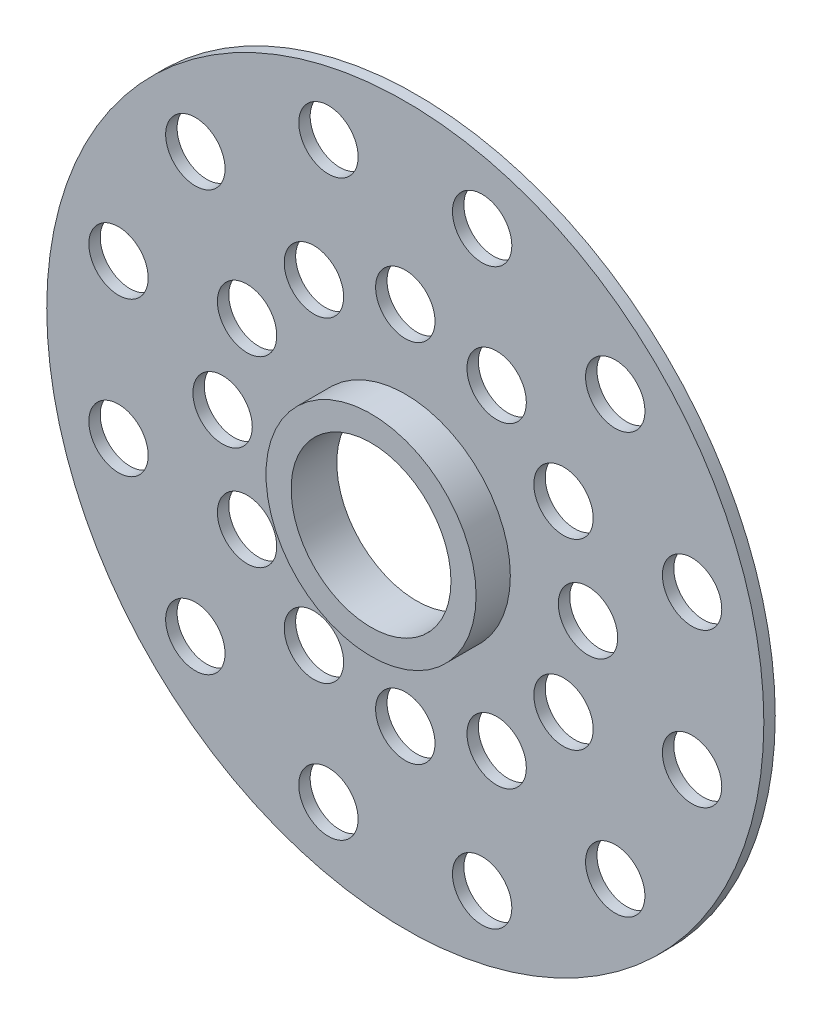
from build123d import *

# Parameters (mm, degrees)
REAR_COVER_REFERENCE_START   = -47
SKETCH_1_R                   = 78.5
SKETCH_1_R_2                 = 17.5
REAR_COVER_REFERENCE_DEPTH   = 2.5
BEARING_BOSS_REFERENCE_START = -47
SKETCH_2_R                   = 23
SKETCH_2_R_2                 = 17.5
BEARING_BOSS_REFERENCE_DEPTH = 10
SKETCH_3_R                   = 6.5
THROUGH_HOLES_DEPTH          = 100


with BuildPart() as part:
    # Эскиз1 → Rear_cover_reference (new body)
    with BuildSketch(Plane.XY.offset(REAR_COVER_REFERENCE_START)):
        Circle(SKETCH_1_R)
        Circle(SKETCH_1_R_2, mode=Mode.SUBTRACT)
    extrude(amount=REAR_COVER_REFERENCE_DEPTH)

    # Эскиз2 → Bearing_boss_reference (add)
    with BuildSketch(Plane.XY.offset(BEARING_BOSS_REFERENCE_START)):
        Circle(SKETCH_2_R)
        Circle(SKETCH_2_R_2, mode=Mode.SUBTRACT)
    extrude(amount=BEARING_BOSS_REFERENCE_DEPTH)

    # Эскиз3 → Through_holes (cut, symmetric)
    with BuildSketch(Plane.XY):
        with Locations((40, 0)):
            Circle(SKETCH_3_R)
        with Locations((34.641016151, 20)):
            Circle(SKETCH_3_R)
        with Locations((20, 34.641016151)):
            Circle(SKETCH_3_R)
        with Locations((0, 40)):
            Circle(SKETCH_3_R)
        with Locations((-20, 34.641016151)):
            Circle(SKETCH_3_R)
        with Locations((-34.641016151, 20)):
            Circle(SKETCH_3_R)
        with Locations((-40, 0)):
            Circle(SKETCH_3_R)
        with Locations((-34.641016151, -20)):
            Circle(SKETCH_3_R)
        with Locations((-20, -34.641016151)):
            Circle(SKETCH_3_R)
        with Locations((0, -40)):
            Circle(SKETCH_3_R)
        with Locations((20, -34.641016151)):
            Circle(SKETCH_3_R)
        with Locations((34.641016151, -20)):
            Circle(SKETCH_3_R)
        with Locations((62.785178709, 16.823237932)):
            Circle(SKETCH_3_R)
        with Locations((45.961940777, 45.961940777)):
            Circle(SKETCH_3_R)
        with Locations((16.823237932, 62.785178709)):
            Circle(SKETCH_3_R)
        with Locations((-16.823237932, 62.785178709)):
            Circle(SKETCH_3_R)
        with Locations((-45.961940777, 45.961940777)):
            Circle(SKETCH_3_R)
        with Locations((-62.785178709, 16.823237932)):
            Circle(SKETCH_3_R)
        with Locations((-62.785178709, -16.823237932)):
            Circle(SKETCH_3_R)
        with Locations((-45.961940777, -45.961940777)):
            Circle(SKETCH_3_R)
        with Locations((-16.823237932, -62.785178709)):
            Circle(SKETCH_3_R)
        with Locations((16.823237932, -62.785178709)):
            Circle(SKETCH_3_R)
        with Locations((45.961940777, -45.961940777)):
            Circle(SKETCH_3_R)
        with Locations((62.785178709, -16.823237932)):
            Circle(SKETCH_3_R)
    extrude(amount=THROUGH_HOLES_DEPTH, both=True, mode=Mode.SUBTRACT)


solid = part.part
